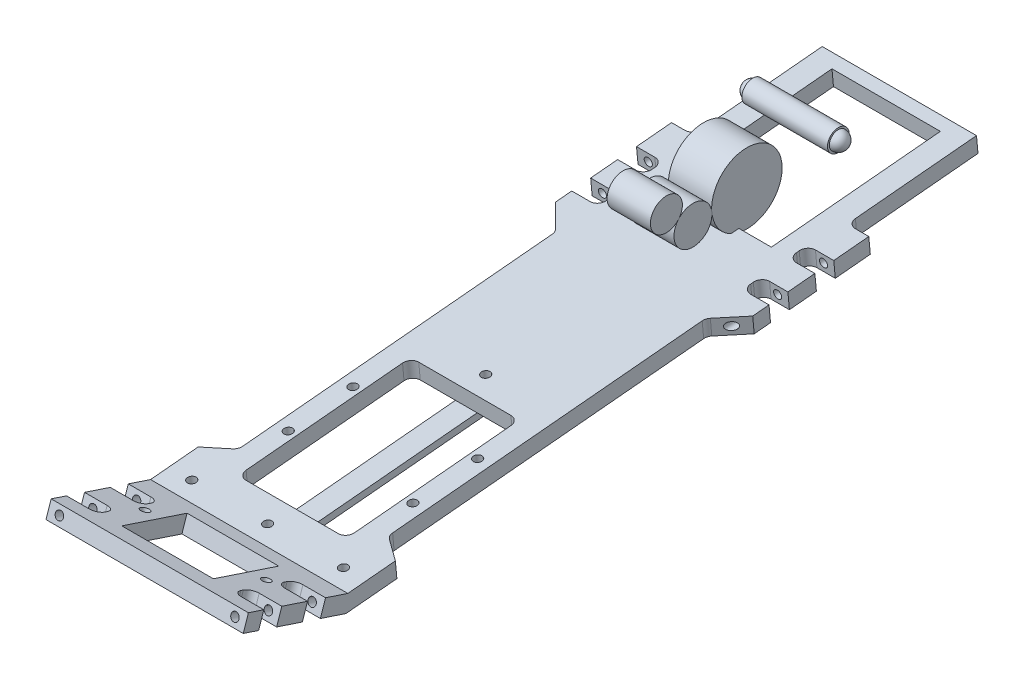
from build123d import *

# Parameters (mm, degrees)
FRAME_DEPTH              = 46.228
SKETCH7_R                = 2.032
SKETCH7_W                = 50.8
SKETCH7_H                = 79.558431861
BATTERY_SLOT_DEPTH       = 32.131
EXTRUDE25_DEPTH          = 12.7
LOW_A_ARM_MOUNTING_DEPTH = 18.288
SKETCH25_R               = 1.905
REAR_HINGE_HOLES_DEPTH   = 72.39
SKETCH26_R               = 16.51
EXTRUDE18_DEPTH          = 10.16
EXTRUDE18_2_DEPTH        = 10.16
SKETCH26_R_2             = 7.493
EXTRUDE18_3_DEPTH        = 10.16
SKETCH32_R               = 2.032
SKETCH32_W               = 42.951687192
SKETCH32_H               = 32.245461994
EXTRUDE24_DEPTH          = 48.26
SKETCH34_R               = 1.905
EXTRUDE26_DEPTH          = 45.72
SKETCH38_R               = 2.032
EXTRUDE29_DEPTH          = 10
SKETCH35_R               = 2.032
EXTRUDE30_DEPTH          = 3.175
SKETCH27_R               = 5.08
EXTRUDE31_DEPTH          = 20.066


with BuildPart() as part:
    # Sketch2 → Frame (new, symmetric)
    with BuildSketch(Plane(origin=(0, 0, 0), x_dir=(0, 0, -1), z_dir=(1, 0, 0))):
        Polygon((-113.496221263, -18.267135855), (-65.375232853, -34.246135229), (240.957112838, -5.655562725), (240.249001379, 1.931464239), (-64.49133225, -26.510522792), (-111.094862411, -11.035408837), align=None)
    extrude(amount=FRAME_DEPTH, both=True)

    # Sketch7 → Battery Slot (cut)
    with BuildSketch(Plane(origin=(0, -20.314469691, -1.895987566), x_dir=(1, 0, 0), z_dir=(0, 0.9956728299897474, 0.0929280131080388))):
        with Locations((29.216865034, 11.53061946)):
            Circle(SKETCH7_R)
        with Locations((-29.216865034, 11.53061946)):
            Circle(SKETCH7_R)
        with Locations((-29.216865034, -18.94938054)):
            Circle(SKETCH7_R)
        with Locations((29.216865034, -18.94938054)):
            Circle(SKETCH7_R)
        with BuildLine():
            Line((-21.59, 34.834750886), (21.59, 34.834750886))
            ThreePointArc((21.59, 34.834750886), (24.284076836, 33.718827722), (25.4, 31.024750886))
            Line((25.4, 31.024750886), (25.4, -42.602437917))
            ThreePointArc((25.4, -42.602437917), (24.284076836, -45.296514753), (21.59, -46.412437917))
            Line((21.59, -46.412437917), (-21.59, -46.412437917))
            ThreePointArc((-21.59, -46.412437917), (-24.284076836, -45.296514753), (-25.4, -42.602437917))
            Line((-25.4, -42.602437917), (-25.4, 31.024750886))
            ThreePointArc((-25.4, 31.024750886), (-24.284076836, 33.718827722), (-21.59, 34.834750886))
        make_face()
        with BuildLine():
            Line((55.96082371, -51.188879708), (36.758181354, -37.566371958))
            ThreePointArc((36.758181354, -37.566371958), (35.577748237, -36.207761713), (35.152650581, -34.458894617))
            Line((35.152650581, -34.458894617), (35.152650581, 111.272094787))
            ThreePointArc((35.152650581, 111.272094787), (35.442669563, 112.730118664), (36.268573745, 113.966171623))
            Line((36.268573745, 113.966171623), (55.96082371, 133.658421588))
            Line((55.96082371, 133.658421588), (55.96082371, -51.188879708))
        make_face()
        with BuildLine():
            Line((-55.96082371, 133.658421588), (-55.96082371, -51.188879708))
            Line((-55.96082371, -51.188879708), (-36.758181354, -37.566371958))
            ThreePointArc((-36.758181354, -37.566371958), (-35.577748237, -36.207761713), (-35.152650581, -34.458894617))
            Line((-35.152650581, -34.458894617), (-35.152650581, 111.272094787))
            ThreePointArc((-35.152650581, 111.272094787), (-35.442669563, 112.730118664), (-36.268573745, 113.966171623))
            Line((-36.268573745, 113.966171623), (-55.96082371, 133.658421588))
        make_face()
        with Locations((0, 193.404599689)):
            Rectangle(SKETCH7_W, SKETCH7_H)
    extrude(amount=-BATTERY_SLOT_DEPTH, mode=Mode.SUBTRACT)

    # Sketch20 → Extrude25 (cut)
    with BuildSketch(Plane(origin=(0, -50.397568307, 16.734957844), x_dir=(1, 0, 0), z_dir=(0, -0.9490455404212153, 0.31513895698025596))):
        with BuildLine():
            Line((54.692263435, 94.336396504), (35.646708176, 94.336396504))
            ThreePointArc((35.646708176, 94.336396504), (32.952631339, 93.22047334), (31.836708176, 90.526396504))
            Line((31.836708176, 90.526396504), (31.836708176, 89.256396504))
            ThreePointArc((31.836708176, 89.256396504), (32.952631339, 86.562319667), (35.646708176, 85.446396504))
            Line((35.646708176, 85.446396504), (51.961047829, 85.446396504))
            Line((51.961047829, 85.446396504), (51.961047829, 72.746396504))
            Line((51.961047829, 72.746396504), (35.646708176, 72.746396504))
            ThreePointArc((35.646708176, 72.746396504), (32.952631339, 71.63047334), (31.836708176, 68.936396504))
            Line((31.836708176, 68.936396504), (31.836708176, 67.666396504))
            ThreePointArc((31.836708176, 67.666396504), (32.952631339, 64.972319667), (35.646708176, 63.856396504))
            Line((35.646708176, 63.856396504), (54.692263435, 63.856396504))
            Line((54.692263435, 63.856396504), (54.692263435, 94.336396504))
        make_face()
        with BuildLine():
            Line((-31.836708176, 68.936396504), (-31.836708176, 67.666396504))
            ThreePointArc((-31.836708176, 67.666396504), (-32.952631339, 64.972319667), (-35.646708176, 63.856396504))
            Line((-35.646708176, 63.856396504), (-54.692263435, 63.856396504))
            Line((-54.692263435, 63.856396504), (-54.692263435, 94.336396504))
            Line((-54.692263435, 94.336396504), (-35.646708176, 94.336396504))
            ThreePointArc((-35.646708176, 94.336396504), (-32.952631339, 93.22047334), (-31.836708176, 90.526396504))
            Line((-31.836708176, 90.526396504), (-31.836708176, 89.256396504))
            ThreePointArc((-31.836708176, 89.256396504), (-32.952631339, 86.562319667), (-35.646708176, 85.446396504))
            Line((-35.646708176, 85.446396504), (-51.961047829, 85.446396504))
            Line((-51.961047829, 85.446396504), (-51.961047829, 72.746396504))
            Line((-51.961047829, 72.746396504), (-35.646708176, 72.746396504))
            ThreePointArc((-35.646708176, 72.746396504), (-32.952631339, 71.63047334), (-31.836708176, 68.936396504))
        make_face()
    extrude(amount=-EXTRUDE25_DEPTH, mode=Mode.SUBTRACT)

    # Sketch24 → Low A-Arm Mounting (cut)
    with BuildSketch(Plane(origin=(0, -20.314469691, -1.895987566), x_dir=(1, 0, 0), z_dir=(0, 0.9956728299897474, 0.0929280131080388))):
        with BuildLine():
            Line((56.409110401, 131.608548499), (56.409110401, 162.088520321))
            Line((56.409110401, 162.088520321), (37.634475113, 162.088520321))
            ThreePointArc((37.634475113, 162.088520321), (34.940398277, 160.972597157), (33.824475113, 158.278520321))
            Line((33.824475113, 158.278520321), (33.824475113, 157.00853441))
            ThreePointArc((33.824475113, 157.00853441), (34.940398277, 154.314457574), (37.634475113, 153.19853441))
            Line((37.634475113, 153.19853441), (52.193835241, 153.19853441))
            Line((52.193835241, 153.19853441), (52.193835241, 140.49853441))
            Line((52.193835241, 140.49853441), (37.634475113, 140.49853441))
            ThreePointArc((37.634475113, 140.49853441), (34.940398277, 139.382611246), (33.824475113, 136.68853441))
            Line((33.824475113, 136.68853441), (33.824475113, 135.418548499))
            ThreePointArc((33.824475113, 135.418548499), (34.940398277, 132.724471663), (37.634475113, 131.608548499))
            Line((37.634475113, 131.608548499), (56.409110401, 131.608548499))
        make_face()
        with BuildLine():
            Line((-37.634475113, 131.608548499), (-56.409110401, 131.608548499))
            Line((-56.409110401, 131.608548499), (-56.409110401, 162.088520321))
            Line((-56.409110401, 162.088520321), (-37.634475113, 162.088520321))
            ThreePointArc((-37.634475113, 162.088520321), (-34.940398277, 160.972597157), (-33.824475113, 158.278520321))
            Line((-33.824475113, 158.278520321), (-33.824475113, 157.00853441))
            ThreePointArc((-33.824475113, 157.00853441), (-34.940398277, 154.314457574), (-37.634475113, 153.19853441))
            Line((-37.634475113, 153.19853441), (-52.193835241, 153.19853441))
            Line((-52.193835241, 153.19853441), (-52.193835241, 140.49853441))
            Line((-52.193835241, 140.49853441), (-37.634475113, 140.49853441))
            ThreePointArc((-37.634475113, 140.49853441), (-34.940398277, 139.382611246), (-33.824475113, 136.68853441))
            Line((-33.824475113, 136.68853441), (-33.824475113, 135.418548499))
            ThreePointArc((-33.824475113, 135.418548499), (-34.940398277, 132.724471663), (-37.634475113, 131.608548499))
        make_face()
        with BuildLine():
            Line((53.936799282, 178.580508489), (39.968592698, 178.580508489))
            ThreePointArc((39.968592698, 178.580508489), (37.274515862, 179.696431653), (36.158592698, 182.390508489))
            Line((36.158592698, 182.390508489), (36.158592698, 260.10008012))
            Line((36.158592698, 260.10008012), (78.039581197, 260.10008012))
            Line((78.039581197, 260.10008012), (53.936799282, 178.580508489))
        make_face()
        with BuildLine():
            Line((-78.039581197, 260.10008012), (-53.936799282, 178.580508489))
            Line((-53.936799282, 178.580508489), (-39.968592698, 178.580508489))
            ThreePointArc((-39.968592698, 178.580508489), (-37.274515862, 179.696431653), (-36.158592698, 182.390508489))
            Line((-36.158592698, 182.390508489), (-36.158592698, 260.10008012))
            Line((-36.158592698, 260.10008012), (-78.039581197, 260.10008012))
        make_face()
    extrude(amount=-LOW_A_ARM_MOUNTING_DEPTH, mode=Mode.SUBTRACT)

    # Sketch25 → Rear Hinge Holes (cut)
    with BuildSketch(Plane(origin=(0, 16.595131834, -177.807760268), x_dir=(-1, 0, 0), z_dir=(0, 0.09292801310803883, -0.9956728299897473))):
        with Locations((-41.073322363, -24.212755884)):
            Circle(SKETCH25_R)
        with Locations((41.073322363, -24.212755884)):
            Circle(SKETCH25_R)
    extrude(amount=-REAR_HINGE_HOLES_DEPTH, mode=Mode.SUBTRACT)

    # Sketch32 → Extrude24 (cut)
    with BuildSketch(Plane(origin=(0, -50.397568307, 16.734957844), x_dir=(1, 0, 0), z_dir=(0, -0.9490455404212153, 0.31513895698025585))):
        with Locations((28.407237147, 74.333896504)):
            Circle(SKETCH32_R)
        with Locations((-28.407237147, 74.333896504)):
            Circle(SKETCH32_R)
        with Locations((0, 77.015866104)):
            Rectangle(SKETCH32_W, SKETCH32_H)
    extrude(amount=-EXTRUDE24_DEPTH, mode=Mode.SUBTRACT)

    # Sketch34 → Extrude26 (cut)
    with BuildSketch(Plane(origin=(0, 32.130432452, 96.761263419), x_dir=(1, 0, 0), z_dir=(0, 0.3151389569802559, 0.9490455404212153))):
        with Locations((-41.141846717, -49.29342461)):
            Circle(SKETCH34_R)
        with Locations((41.141846717, -49.29342461)):
            Circle(SKETCH34_R)
    extrude(amount=-EXTRUDE26_DEPTH, mode=Mode.SUBTRACT)

    # Sketch38 → Extrude29 (cut)
    with BuildSketch(Plane(origin=(0, -20.314469691, -1.895987566), x_dir=(1, 0, 0), z_dir=(0, 0.9956728299897474, 0.0929280131080388))):
        with Locations((0, -57.996941554)):
            Circle(SKETCH38_R)
        with Locations((35.56, -57.996941554)):
            Circle(SKETCH38_R)
        with Locations((-35.56, -57.996941554)):
            Circle(SKETCH38_R)
        with Locations((0, 44.661295459)):
            Circle(SKETCH38_R)
    extrude(amount=-EXTRUDE29_DEPTH, mode=Mode.SUBTRACT)


with BuildPart() as body_2:
    # Sketch26 → Extrude18 (new, symmetric)
    with BuildSketch(Plane(origin=(0, 0, 0), x_dir=(0, 0, -1), z_dir=(1, 0, 0))):
        with Locations((158.63131502, 8.344645738)):
            Circle(SKETCH26_R)
    extrude(amount=EXTRUDE18_DEPTH, both=True)


with BuildPart() as body_3:
    # Sketch26 → Extrude18 2 (new, symmetric)
    with BuildSketch(Plane(origin=(0, 0, 0), x_dir=(0, 0, -1), z_dir=(1, 0, 0))):
        with BuildLine():
            ThreePointArc((142.192481652, 6.813352989), (136.038170827, 14.45971983), (126.595687803, 11.779797825))
            ThreePointArc((126.595687803, 11.779797825), (130.643433481, -2.482098519), (142.192481652, 6.813352989))
        make_face()
    extrude(amount=EXTRUDE18_2_DEPTH, both=True)


with BuildPart() as body_4:
    # Sketch26 → Extrude18 3 (new, symmetric)
    with BuildSketch(Plane(origin=(0, 0, 0), x_dir=(0, 0, -1), z_dir=(1, 0, 0))):
        with Locations((120.910520386, 16.660773183)):
            Circle(SKETCH26_R_2)
    extrude(amount=EXTRUDE18_3_DEPTH, both=True)


with BuildPart() as body_5:
    # Sketch35 → Extrude30 (new body)
    with BuildSketch(Plane(origin=(0, -27.901496655, -2.604099026), x_dir=(1, 0, 0), z_dir=(0, -0.9956728299897473, -0.09292801310803918))):
        with BuildLine():
            Line((5.08, 57.970513217), (5.08, -44.661295459))
            ThreePointArc((5.08, -44.661295459), (0, -49.741295459), (-5.08, -44.661295459))
            Line((-5.08, -44.661295459), (-5.078790691, 57.859674963))
            ThreePointArc((-5.078790691, 57.859674963), (-0.055422426, 63.050210881), (5.08, 57.970513217))
        make_face()
        with Locations((0, -44.661295459)):
            Circle(SKETCH35_R, mode=Mode.SUBTRACT)
        with Locations((0, 57.970513217)):
            Circle(SKETCH35_R, mode=Mode.SUBTRACT)
    extrude(amount=EXTRUDE30_DEPTH)


with BuildPart() as body_6:
    # Sketch27 → Extrude31 (new, symmetric)
    with BuildSketch(Plane(origin=(0, 0, 0), x_dir=(0, 0, -1), z_dir=(1, 0, 0))):
        with Locations((191.590214671, 16.382140366)):
            Circle(SKETCH27_R)
    extrude(amount=EXTRUDE31_DEPTH, both=True)

    # Sketch40 → Revolve1 (revolve)
    with BuildSketch(Plane.ZY.offset(20.066)):
        with BuildLine():
            Line((-191.590214671, 20.633380788), (-191.590214671, 12.198456206))
            ThreePointArc((-191.590214671, 12.198456206), (-187.37275238, 16.415918497), (-191.590214671, 20.633380788))
        make_face()
    revolve1 = revolve(axis=Axis((-20.066, 20.633380788, -191.590214671), (0, -1, 0)))

    # Mirror1: Revolve1 across plane
    add(revolve1.mirror(Plane(origin=(0, 0, 0), x_dir=(0, 0, 1), z_dir=(1, 0, 0))))


solid = Compound([part.part, body_2.part, body_3.part, body_4.part, body_5.part, body_6.part])
